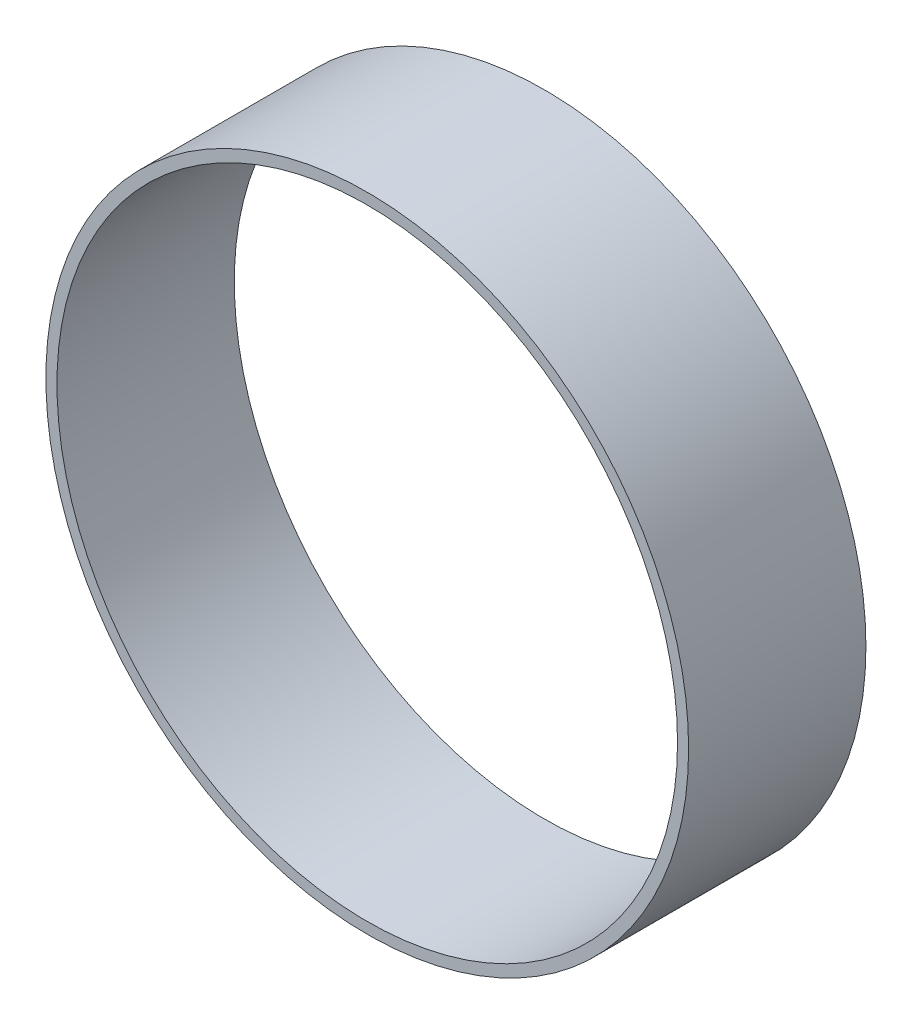
from build123d import *

# Parameters (mm, degrees)
SKETCH1_R           = 72.5
SKETCH1_R_2         = 70
BOSS_EXTRUDE1_DEPTH = 40


with BuildPart() as part:
    # Sketch1 → Boss-Extrude1 (new body)
    with BuildSketch(Plane.XY):
        Circle(SKETCH1_R)
        Circle(SKETCH1_R_2, mode=Mode.SUBTRACT)
    extrude(amount=BOSS_EXTRUDE1_DEPTH)


solid = part.part
